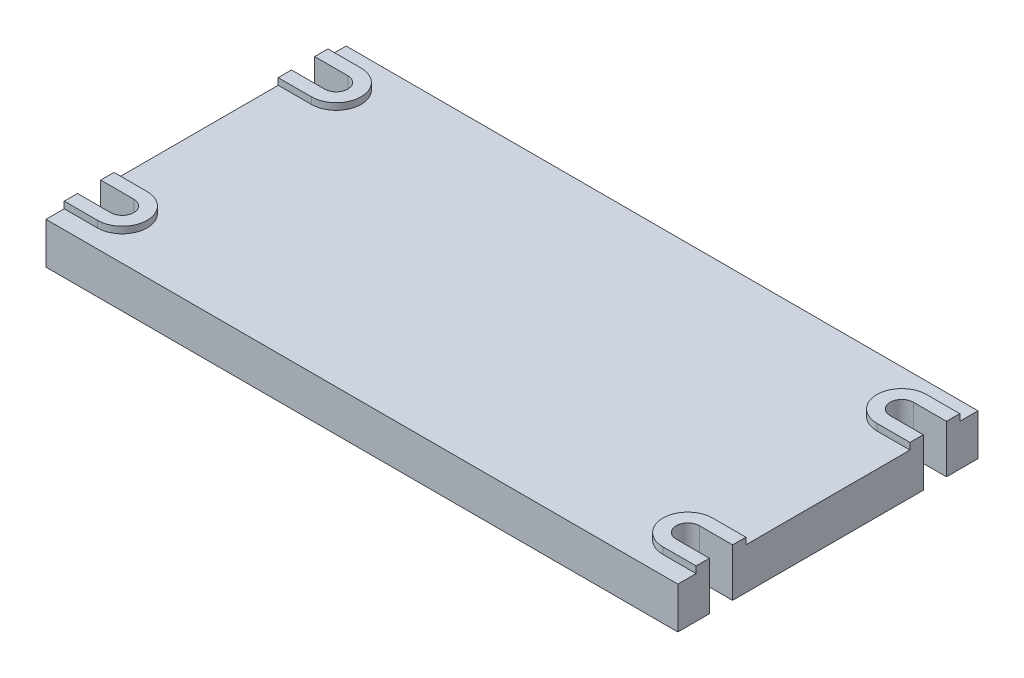
from build123d import *

# Parameters (mm, degrees)
SKETCH_1_W            = 381
SKETCH_1_H            = 181
EXTRUDE_1_DEPTH       = 25
CUT_EXTRUDE_1_DEPTH   = 25
EXTRUDE_START         = 4
EXTRUDE_2_DEPTH       = 4
MIRROR_2_COPY_1_DEPTH = 25
MIRROR_START          = 4
MIRROR_2_COPY_2_DEPTH = 4
MIRROR_2_COPY_3_DEPTH = 25
MIRROR_2_COPY_4_DEPTH = 4


with BuildPart() as part:
    # 草图1 → 凸台-拉伸1 (new body)
    with BuildSketch(Plane(origin=(0, 0, 0), x_dir=(1, 0, 0), z_dir=(0, 1, 0))):
        Rectangle(SKETCH_1_W, SKETCH_1_H)
    extrude(amount=EXTRUDE_1_DEPTH)

    # 草图2 → 切除-拉伸1 (cut)
    with BuildSketch(Plane(origin=(0, 25, 0), x_dir=(1, 0, 0), z_dir=(0, 1, 0))):
        with BuildLine():
            Line((-190.5, 57.5), (-170.5, 57.5))
            ThreePointArc((-170.5, 57.5), (-163.5, 64.5), (-170.5, 71.5))
            Line((-170.5, 71.5), (-190.5, 71.5))
            Line((-190.5, 71.5), (-190.5, 57.5))
        make_face()
    cut_extrude_1 = extrude(amount=-CUT_EXTRUDE_1_DEPTH, mode=Mode.SUBTRACT)

    # 草图2<3> → 凸台-拉伸2 (add)
    with BuildSketch(Plane(origin=(0, 25, 0), x_dir=(1, 0, 0), z_dir=(0, 1, 0)).offset(EXTRUDE_START)):
        with BuildLine():
            ThreePointArc((-170.5, 71.5), (-163.5, 64.5), (-170.5, 57.5))
            Line((-170.5, 57.5), (-190.5, 57.5))
            Line((-190.5, 57.5), (-190.5, 49.5))
            Line((-190.5, 49.5), (-170.5, 49.5))
            ThreePointArc((-170.5, 49.5), (-155.5, 64.5), (-170.5, 79.5))
            Line((-170.5, 79.5), (-190.5, 79.5))
            Line((-190.5, 79.5), (-190.5, 71.5))
            Line((-190.5, 71.5), (-170.5, 71.5))
        make_face()
    extrude_2 = extrude(amount=-EXTRUDE_2_DEPTH)

    # 镜向1: 切除-拉伸1, 凸台-拉伸2 across plane
    add(cut_extrude_1.mirror(Plane.XY), mode=Mode.SUBTRACT)
    add(extrude_2.mirror(Plane.XY))

    # 镜向2 copy 1 sketch → 镜向2 copy 1 (cut)
    with BuildSketch(Plane(origin=(0, 25, 0), x_dir=(-1, 0, 0), z_dir=(0, 1, 0))):
        with BuildLine():
            Line((-190.5, 57.5), (-170.5, 57.5))
            ThreePointArc((-170.5, 57.5), (-163.5, 64.5), (-170.5, 71.5))
            Line((-170.5, 71.5), (-190.5, 71.5))
            Line((-190.5, 71.5), (-190.5, 57.5))
        make_face()
    extrude(amount=-MIRROR_2_COPY_1_DEPTH, mode=Mode.SUBTRACT)

    # 镜向2 copy 2 sketch → 镜向2 copy 2 (add)
    with BuildSketch(Plane(origin=(0, 25, 0), x_dir=(-1, 0, 0), z_dir=(0, 1, 0)).offset(MIRROR_START)):
        with BuildLine():
            ThreePointArc((-170.5, 71.5), (-163.5, 64.5), (-170.5, 57.5))
            Line((-170.5, 57.5), (-190.5, 57.5))
            Line((-190.5, 57.5), (-190.5, 49.5))
            Line((-190.5, 49.5), (-170.5, 49.5))
            ThreePointArc((-170.5, 49.5), (-155.5, 64.5), (-170.5, 79.5))
            Line((-170.5, 79.5), (-190.5, 79.5))
            Line((-190.5, 79.5), (-190.5, 71.5))
            Line((-190.5, 71.5), (-170.5, 71.5))
        make_face()
    extrude(amount=-MIRROR_2_COPY_2_DEPTH)

    # 镜向2 copy 3 sketch → 镜向2 copy 3 (cut)
    with BuildSketch(Plane(origin=(0, 25, 0), x_dir=(-1, 0, 0), z_dir=(0, 1, 0))):
        with BuildLine():
            Line((-190.5, -57.5), (-170.5, -57.5))
            ThreePointArc((-170.5, -57.5), (-163.5, -64.5), (-170.5, -71.5))
            Line((-170.5, -71.5), (-190.5, -71.5))
            Line((-190.5, -71.5), (-190.5, -57.5))
        make_face()
    extrude(amount=-MIRROR_2_COPY_3_DEPTH, mode=Mode.SUBTRACT)

    # 镜向2 copy 4 sketch → 镜向2 copy 4 (add)
    with BuildSketch(Plane(origin=(0, 25, 0), x_dir=(-1, 0, 0), z_dir=(0, 1, 0)).offset(MIRROR_START)):
        with BuildLine():
            ThreePointArc((-170.5, -71.5), (-163.5, -64.5), (-170.5, -57.5))
            Line((-170.5, -57.5), (-190.5, -57.5))
            Line((-190.5, -57.5), (-190.5, -49.5))
            Line((-190.5, -49.5), (-170.5, -49.5))
            ThreePointArc((-170.5, -49.5), (-155.5, -64.5), (-170.5, -79.5))
            Line((-170.5, -79.5), (-190.5, -79.5))
            Line((-190.5, -79.5), (-190.5, -71.5))
            Line((-190.5, -71.5), (-170.5, -71.5))
        make_face()
    extrude(amount=-MIRROR_2_COPY_4_DEPTH)


solid = part.part
